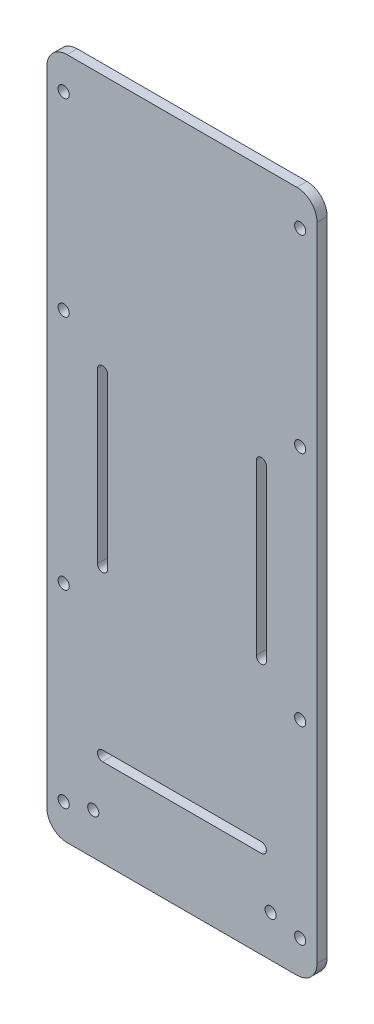
from build123d import *

# Parameters (mm, degrees)
SKETCH_1_R          = 1.65
EXTRUDE_1_DEPTH     = 3
SKETCH_2_R          = 1.65
CUT_EXTRUDE_1_DEPTH = 109.673823895


with BuildPart() as part:
    # Эскиз1 → Бобышка-Вытянуть1 (new body)
    with BuildSketch(Plane.XY):
        with BuildLine():
            Line((-34, 101), (34, 101))
            ThreePointArc((34, 101), (38.242640687, 99.242640687), (40, 95))
            Line((40, 95), (40, -95))
            ThreePointArc((40, -95), (38.242640687, -99.242640687), (34, -101))
            Line((34, -101), (-34, -101))
            ThreePointArc((-34, -101), (-38.242640687, -99.242640687), (-40, -95))
            Line((-40, -95), (-40, 95))
            ThreePointArc((-40, 95), (-38.242640687, 99.242640687), (-34, 101))
        make_face()
        with Locations((-35, 91)):
            Circle(SKETCH_1_R, mode=Mode.SUBTRACT)
        with Locations((-35, 35)):
            Circle(SKETCH_1_R, mode=Mode.SUBTRACT)
        with Locations(Location((35, 35, 0), (0, 0, 180))):
            Circle(SKETCH_1_R, mode=Mode.SUBTRACT)
        with Locations(Location((35, 91, 0), (0, 0, 180))):
            Circle(SKETCH_1_R, mode=Mode.SUBTRACT)
        with Locations((35, -91)):
            Circle(SKETCH_1_R, mode=Mode.SUBTRACT)
        with Locations(Location((-35, -91, 0), (0, 0, 180))):
            Circle(SKETCH_1_R, mode=Mode.SUBTRACT)
        with Locations(Location((-35, -35, 0), (0, 0, 180))):
            Circle(SKETCH_1_R, mode=Mode.SUBTRACT)
        with Locations((35, -35)):
            Circle(SKETCH_1_R, mode=Mode.SUBTRACT)
    extrude(amount=EXTRUDE_1_DEPTH)

    # Эскиз2 → Вырез-Вытянуть1 (cut, through all)
    with BuildSketch(Plane.XY.offset(3)):
        with Locations((-26.25, -88.75)):
            Circle(SKETCH_2_R)
        with Locations((26.25, -88.75)):
            Circle(SKETCH_2_R)
        with BuildLine():
            Line((-22, 25), (-22, -25))
            ThreePointArc((-22, -25), (-23.5, -26.5), (-25, -25))
            Line((-25, -25), (-25, 25))
            ThreePointArc((-25, 25), (-23.5, 26.5), (-22, 25))
        make_face()
        with BuildLine():
            Line((22, 25), (22, -25))
            ThreePointArc((22, -25), (23.5, -26.5), (25, -25))
            Line((25, -25), (25, 25))
            ThreePointArc((25, 25), (23.5, 26.5), (22, 25))
        make_face()
        with BuildLine():
            Line((-23.5, -75), (23.5, -75))
            ThreePointArc((23.5, -75), (25, -73.5), (23.5, -72))
            Line((23.5, -72), (-23.5, -72))
            ThreePointArc((-23.5, -72), (-25, -73.5), (-23.5, -75))
        make_face()
    extrude(amount=-CUT_EXTRUDE_1_DEPTH, mode=Mode.SUBTRACT)


solid = part.part
